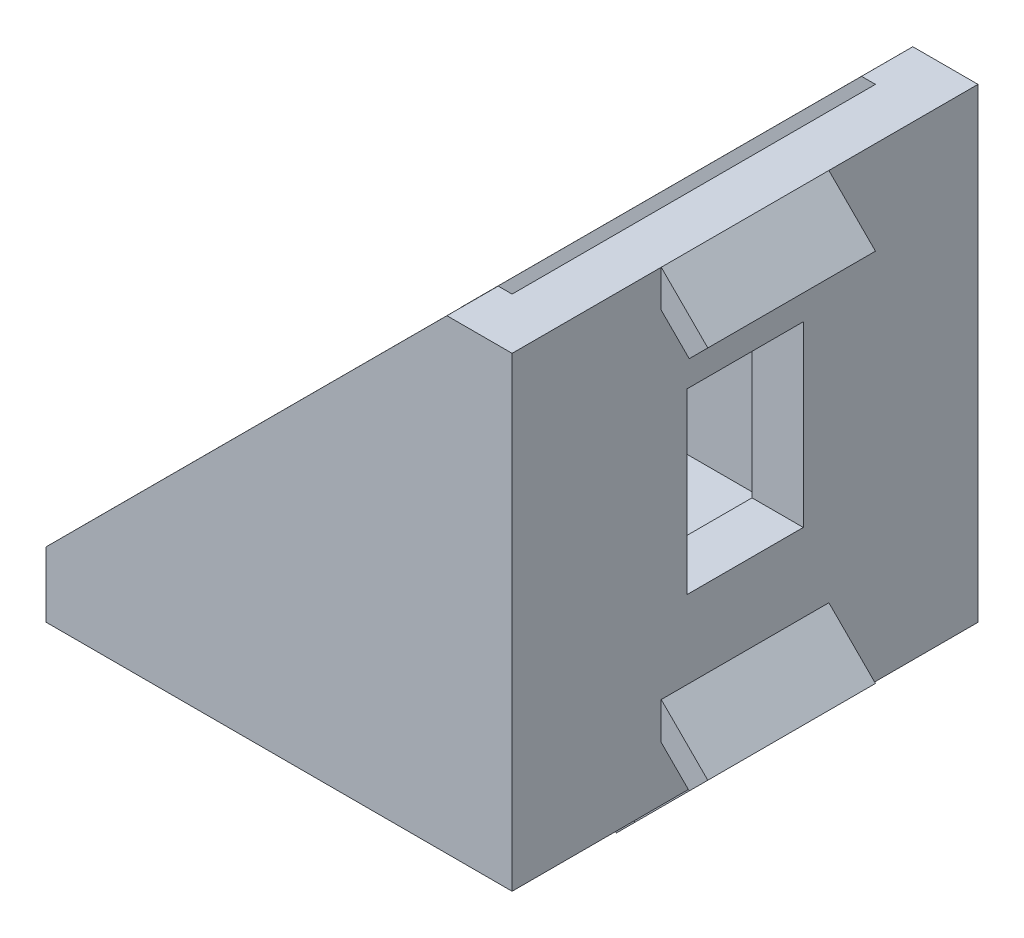
from build123d import *

# Parameters (mm, degrees)
EXTRUDE1_DEPTH          = 9
CUT_EXTRUDE1_DEPTH      = 7.0188
CUT_EXTRUDE1_DEPTH_BACK = 7.0188
SKETCH2_W               = 16.0274
SKETCH2_H               = 16.0188
SKETCH3_W               = 6.8834
SKETCH3_H               = 4.5
CUT_EXTRUDE2_DEPTH      = 22.046236615
SKETCH4_W               = 4.5
SKETCH4_H               = 6.8834
CUT_EXTRUDE3_DEPTH      = 22.050687025
EXTRUDE2_DEPTH          = 3.2385


with BuildPart() as part:
    # Sketch1 → Extrude1 (new, symmetric)
    with BuildSketch(Plane.XY):
        Polygon((10.263631045, 7.740668955), (10.263631045, -10.259331045), (-7.744968955, -10.259331045), (-7.744968955, -7.740668955), (7.744968955, 7.740668955), align=None)
    extrude(amount=EXTRUDE1_DEPTH, both=True)

    # Sketch2 → Cut-Extrude1 (cut, two sides: drawn at the far end of the back side and taken through both)
    with BuildSketch(Plane.XY.offset(-CUT_EXTRUDE1_DEPTH_BACK)):
        with Locations((0.268731045, -0.268731045)):
            Rectangle(SKETCH2_W, SKETCH2_H)
    extrude(amount=CUT_EXTRUDE1_DEPTH + CUT_EXTRUDE1_DEPTH_BACK, mode=Mode.SUBTRACT)

    # Sketch3 → Cut-Extrude2 (cut, through all)
    with BuildSketch(Plane(origin=(0, -8.278131045, 0), x_dir=(1, 0, 0), z_dir=(0, 1, 0))):
        with Locations((0.268731045, 0)):
            Rectangle(SKETCH3_W, SKETCH3_H)
    extrude(amount=-CUT_EXTRUDE2_DEPTH, mode=Mode.SUBTRACT)

    # Sketch4 → Cut-Extrude3 (cut, through all)
    with BuildSketch(Plane.ZY.offset(-8.282431045)):
        with Locations((0, -0.268731045)):
            Rectangle(SKETCH4_W, SKETCH4_H)
    extrude(amount=-CUT_EXTRUDE3_DEPTH, mode=Mode.SUBTRACT)

    # Sketch5 → Extrude2 (add, symmetric)
    with BuildSketch(Plane.XY):
        Polygon((10.263631045, 7.740668955), (12.063631045, 5.939669042), (11.345011094, 5.221448069), (10.263631045, 6.303428833), align=None)
        Polygon((10.263631045, -8.161019219), (10.263631045, -6.723779096), (12.063631045, -8.52477901), (11.345011094, -9.242999983), align=None)
        Polygon((-7.744968955, -10.259331045), (-5.945968314, -12.059331045), (-5.227348363, -11.341110071), (-6.308526787, -10.259331045), align=None)
        Polygon((6.728114898, -10.259331045), (8.52711554, -12.059331045), (9.24573549, -11.341110071), (8.164557066, -10.259331045), align=None)
    extrude(amount=EXTRUDE2_DEPTH, both=True)


solid = part.part
